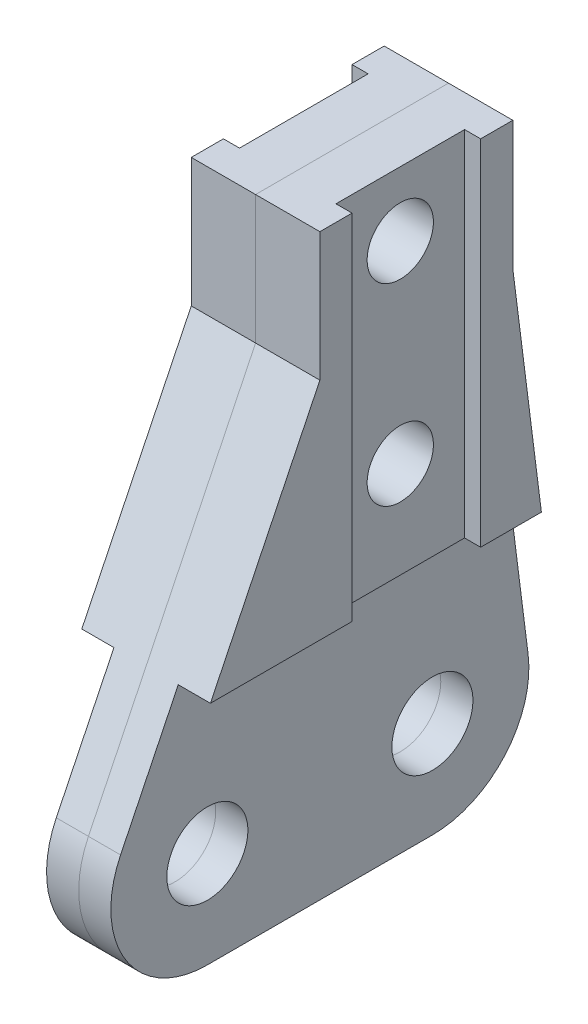
from build123d import *

# Parameters (mm, degrees)
SKETCH1_R           = 8.001
BOSS_EXTRUDE1_DEPTH = 12.7
SKETCH2_W           = 127.926153114
SKETCH2_H           = 63.5
CUT_EXTRUDE1_DEPTH  = 6.35
SKETCH2_3_W         = 25.4
SKETCH2_3_H         = 69.85
CUT_EXTRUDE2_DEPTH  = 3.175
SKETCH3_R           = 6.5484375
CUT_EXTRUDE3_DEPTH  = 75.189091179


with BuildPart() as part:
    # Sketch1 → Boss-Extrude1 (new body)
    with BuildSketch(Plane(origin=(0, 0, 0), x_dir=(0, 0, -1), z_dir=(1, 0, 0))):
        with BuildLine():
            Line((-6.35, 34.925), (-39.356480762, -32.943441508))
            ThreePointArc((-39.356480762, -32.943441508), (-38.374592708, -51.379115764), (-22.225, -60.325))
            Line((-22.225, -60.325), (22.225, -60.325))
            ThreePointArc((22.225, -60.325), (36.518824209, -53.86821601), (41.123185394, -38.874773174))
            Line((41.123185394, -38.874773174), (31.75, 34.925))
            Line((31.75, 34.925), (31.75, 60.325))
            Line((31.75, 60.325), (-6.35, 60.325))
            Line((-6.35, 60.325), (-6.35, 34.925))
        make_face()
        with Locations((-22.225, -41.275)):
            Circle(SKETCH1_R, mode=Mode.SUBTRACT)
        with Locations((22.225, -41.275)):
            Circle(SKETCH1_R, mode=Mode.SUBTRACT)
    extrude(amount=BOSS_EXTRUDE1_DEPTH)

    # Sketch2 → Cut-Extrude1 (cut)
    with BuildSketch(Plane(origin=(12.7, 0, 0), x_dir=(0, 0, -1), z_dir=(1, 0, 0))):
        with Locations((0, -41.275)):
            Rectangle(SKETCH2_W, SKETCH2_H)
    extrude(amount=-CUT_EXTRUDE1_DEPTH, mode=Mode.SUBTRACT)

    # Sketch2<3> → Cut-Extrude2 (cut)
    with BuildSketch(Plane(origin=(12.7, 0, 0), x_dir=(0, 0, -1), z_dir=(1, 0, 0))):
        with Locations((12.7, 25.4)):
            Rectangle(SKETCH2_3_W, SKETCH2_3_H)
    extrude(amount=-CUT_EXTRUDE2_DEPTH, mode=Mode.SUBTRACT)


with BuildPart() as body_2:
    # Mirror1: mirrored copy
    add(part.part.mirror(Plane(origin=(0, 0, 0), x_dir=(0, 0, 1), z_dir=(1, 0, 0))))


with BuildPart() as part_1:
    add(part.part)

    # Sketch3 → Cut-Extrude3 (cut, through all)
    with BuildSketch(Plane.ZY):
        with Locations((-12.7, 47.625)):
            Circle(SKETCH3_R)
        with Locations((-12.7, 9.525)):
            Circle(SKETCH3_R)
    extrude(amount=-CUT_EXTRUDE3_DEPTH, mode=Mode.SUBTRACT)


solid = Compound([body_2.part, part_1.part])
